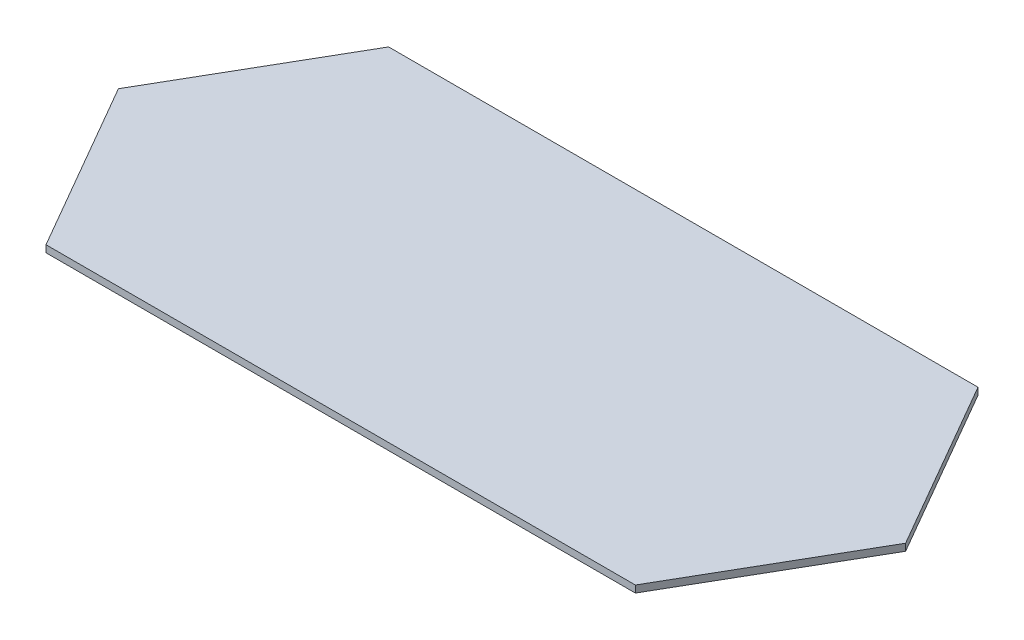
from build123d import *

# Parameters (mm, degrees)
BOSS_EXTRUDE1_DEPTH = 6.35


with BuildPart() as part:
    # Sketch1 → Boss-Extrude1 (new body)
    with BuildSketch(Plane(origin=(0, 0, 0), x_dir=(1, 0, 0), z_dir=(0, 1, 0))):
        Polygon((89.821268129, 155.575), (265.778731871, 155.575), (445.421268129, 155.575), (535.242536258, 0), (445.421268129, -155.575), (265.778731871, -155.575), (89.821268129, -155.575), (-89.821268129, -155.575), (-179.642536258, 0), (-89.821268129, 155.575), align=None)
    extrude(amount=BOSS_EXTRUDE1_DEPTH)


solid = part.part
